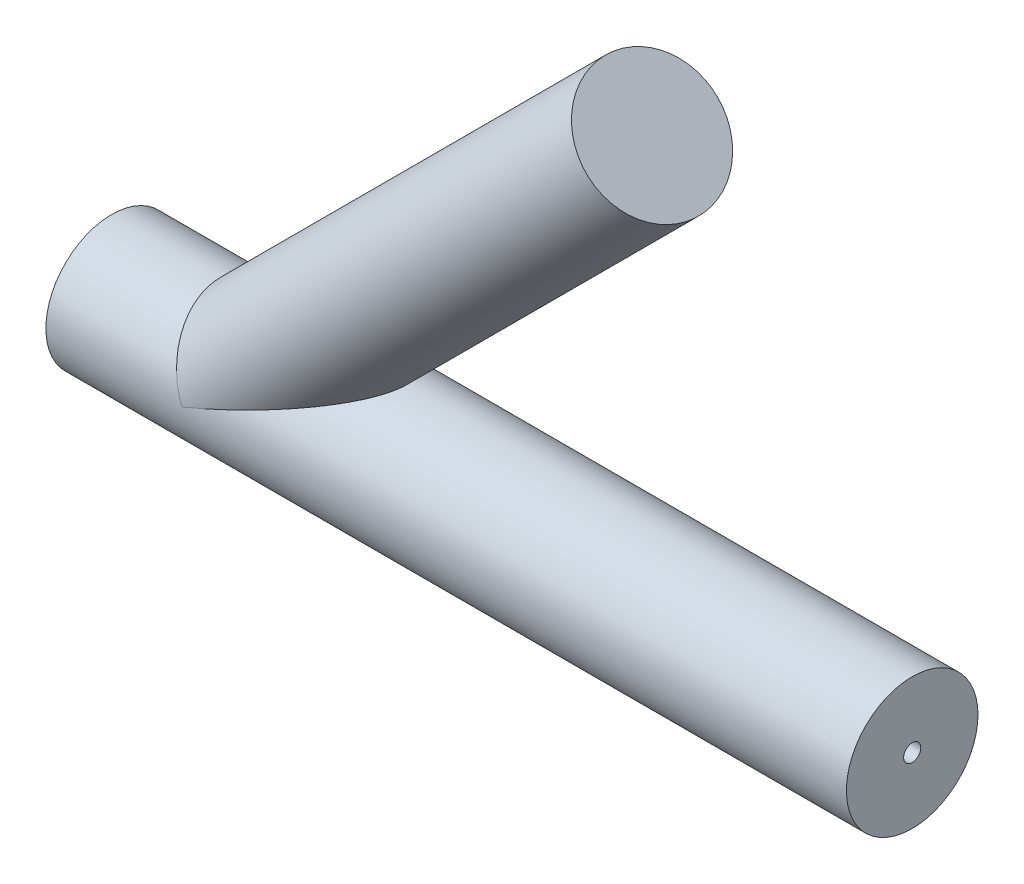
from build123d import *

# Parameters (mm, degrees)
SKETCH1_R           = 28.194
BOSS_EXTRUDE1_DEPTH = 343
SKETCH5_R           = 28.194
BOSS_EXTRUDE3_DEPTH = 245
SKETCH7_R           = 3.675
CUT_EXTRUDE1_DEPTH  = 369.4


with BuildPart() as part:
    # Sketch1 → Boss-Extrude1 (new body)
    with BuildSketch(Plane(origin=(0, 0, 0), x_dir=(0, 0, -1), z_dir=(1, 0, 0))):
        Circle(SKETCH1_R)
    extrude(amount=BOSS_EXTRUDE1_DEPTH)

    # Sketch5 → Boss-Extrude3 (add)
    with BuildSketch(Plane(origin=(29.15, 29.15, 0), x_dir=(0.7071067811865464, -0.7071067811865488, 0), z_dir=(0.7071067811865488, 0.7071067811865464, 0))):
        with Locations(Location((41.224325343, 0, 0), (0, 0, 90))):
            Circle(SKETCH5_R)
    extrude(amount=BOSS_EXTRUDE3_DEPTH)

    # Sketch7 → Cut-Extrude1 (cut)
    with BuildSketch(Plane.ZY):
        Circle(SKETCH7_R)
    extrude(amount=-CUT_EXTRUDE1_DEPTH, mode=Mode.SUBTRACT)


solid = part.part
